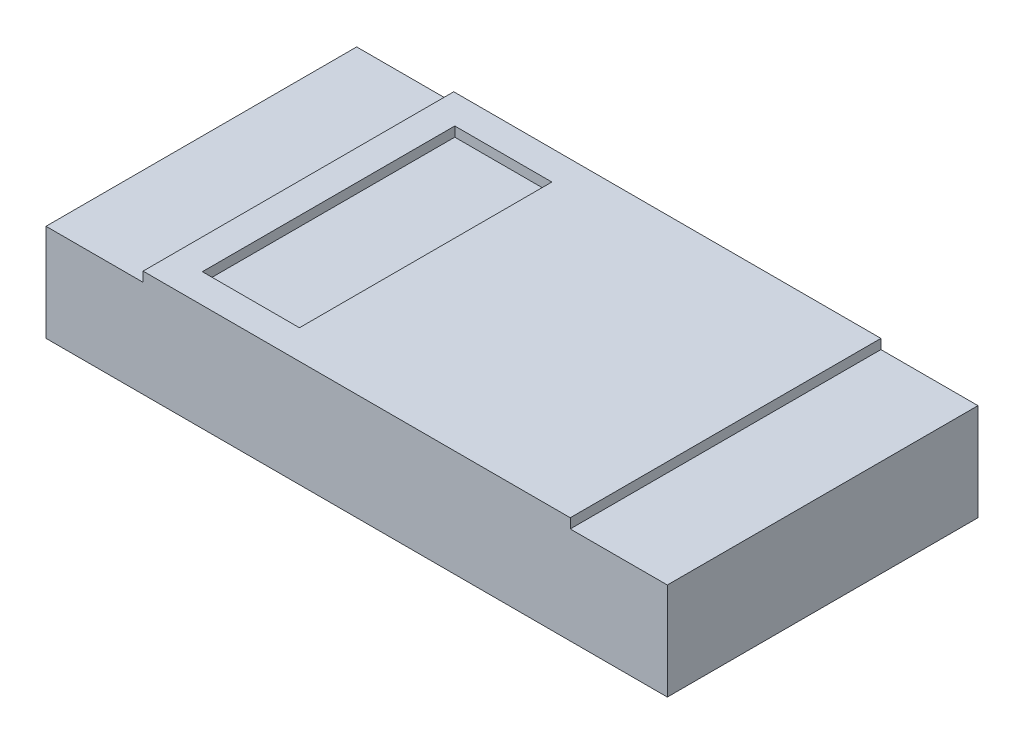
from build123d import *

# Parameters (mm, degrees)
SKETCH1_W           = 3.2
SKETCH1_H           = 1.6
BOSS_EXTRUDE1_DEPTH = 0.5
SKETCH2_W           = 2.2
SKETCH2_H           = 1.6
BOSS_EXTRUDE2_DEPTH = 0.05
SKETCH3_W           = 0.5
SKETCH3_H           = 1.3
CUT_EXTRUDE1_DEPTH  = 0.05


with BuildPart() as part:
    # Sketch1 → Boss-Extrude1 (new body)
    with BuildSketch(Plane(origin=(0, 0, 0), x_dir=(1, 0, 0), z_dir=(0, 1, 0))):
        Rectangle(SKETCH1_W, SKETCH1_H)
    extrude(amount=BOSS_EXTRUDE1_DEPTH)

    # Sketch2 → Boss-Extrude2 (add)
    with BuildSketch(Plane(origin=(0, 0.5, 0), x_dir=(1, 0, 0), z_dir=(0, 1, 0))):
        Rectangle(SKETCH2_W, SKETCH2_H)
    extrude(amount=BOSS_EXTRUDE2_DEPTH)

    # Sketch3 → Cut-Extrude1 (cut)
    with BuildSketch(Plane(origin=(0, 0.55, 0), x_dir=(1, 0, 0), z_dir=(0, 1, 0))):
        with Locations((-0.694727383, 0)):
            Rectangle(SKETCH3_W, SKETCH3_H)
    extrude(amount=-CUT_EXTRUDE1_DEPTH, mode=Mode.SUBTRACT)


solid = part.part
